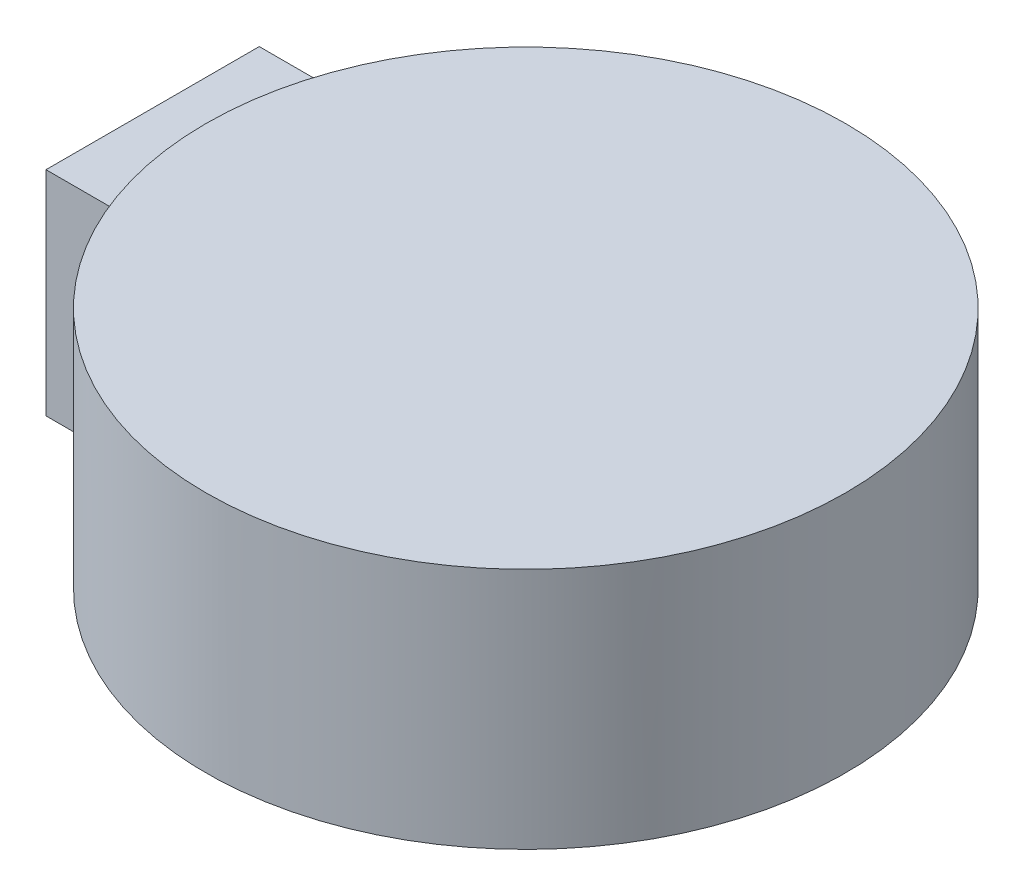
from build123d import *

# Parameters (mm, degrees)
SKETCH_1_R           = 60
SKETCH_1_R_2         = 40
EXTRUDE_1_DEPTH      = 20
SKETCH_2_R           = 60
EXTRUDE_4_DEPTH      = 5
EXTRUDE_5_REACH      = 160.459
EXTRUDE_5_END_RADIUS = 60
EXTRUDE_START        = -70
SKETCH_3_W           = 40
SKETCH_3_H           = 40
SKETCH_4_R           = 2.5
CUT_EXTRUDE_1_DEPTH  = 5
EXTRUDE_START_2      = 10.5
SKETCH_5_R           = 40
EXTRUDE_6_DEPTH      = 10.5
EXTRUDE_7_DEPTH      = 10


with BuildPart() as part:
    # 草图1 → 凸台-拉伸1 (new body)
    with BuildSketch(Plane(origin=(0, 0, 0), x_dir=(1, 0, 0), z_dir=(0, 1, 0))):
        with Locations(Location((0, 0, 0), (0, 0, 270))):
            Circle(SKETCH_1_R)
        with Locations(Location((0, 0, 0), (0, 0, 270))):
            Circle(SKETCH_1_R_2, mode=Mode.SUBTRACT)
    extrude(amount=EXTRUDE_1_DEPTH)

    # 草图2 → 凸台-拉伸4 (add)
    with BuildSketch(Plane(origin=(0, 20, 0), x_dir=(1, 0, 0), z_dir=(0, 1, 0))):
        with Locations(Location((0, 0, 0), (0, 0, 270))):
            Circle(SKETCH_2_R)
    extrude(amount=EXTRUDE_4_DEPTH)

    # 凸台-拉伸5: up to this cylinder (the profile starts outside it)
    extrude_5_end = Plane(origin=(0, 12.5, 0), z_dir=(0, -1, 0)) * Cylinder(EXTRUDE_5_END_RADIUS, 441.918, mode=Mode.PRIVATE)
    # 草图3 → 凸台-拉伸5 (add, up to the surface)
    with BuildSketch(Plane(origin=(0, 0, 0), x_dir=(0, 0, -1), z_dir=(1, 0, 0)).offset(EXTRUDE_START), mode=Mode.PRIVATE) as extrude_5_sk1:
        with Locations((0, 12.5)):
            Rectangle(SKETCH_3_W, SKETCH_3_H)
    extrude_5_tool1 = extrude(extrude_5_sk1.sketch, amount=EXTRUDE_5_REACH, mode=Mode.PRIVATE) - extrude_5_end
    add(extrude_5_tool1.solids().sort_by_distance((-70, 12.5, 0))[0])

    # 草图4 → 切除-拉伸1 (cut)
    with BuildSketch(Plane.ZY.offset(70)):
        with Locations((-15, 27.5)):
            Circle(SKETCH_4_R)
        with Locations((15, 27.5)):
            Circle(SKETCH_4_R)
        with Locations((15, -2.5)):
            Circle(SKETCH_4_R)
        with Locations((-15, -2.5)):
            Circle(SKETCH_4_R)
    extrude(amount=-CUT_EXTRUDE_1_DEPTH, mode=Mode.SUBTRACT)

    # 草图5 → 凸台-拉伸6 (add)
    with BuildSketch(Plane.XZ.offset(EXTRUDE_START_2)):
        with BuildLine():
            ThreePointArc((-56.568542495, 20), (-60, 0), (-56.568542495, -20))
            ThreePointArc((-56.568542495, -20), (60, 0), (-56.568542495, 20))
        make_face()
        with Locations(Location((0, 0, 0), (0, 0, 270))):
            Circle(SKETCH_5_R, mode=Mode.SUBTRACT)
    extrude(amount=-EXTRUDE_6_DEPTH)

    # 草图6 → 凸台-拉伸7 (add)
    with BuildSketch(Plane(origin=(0, 25, 0), x_dir=(1, 0, 0), z_dir=(0, 1, 0))):
        with BuildLine():
            ThreePointArc((-56.568542495, 20), (-60, 0), (-56.568542495, -20))
            ThreePointArc((-56.568542495, -20), (60, 0), (-56.568542495, 20))
        make_face()
    extrude(amount=EXTRUDE_7_DEPTH)


solid = part.part
